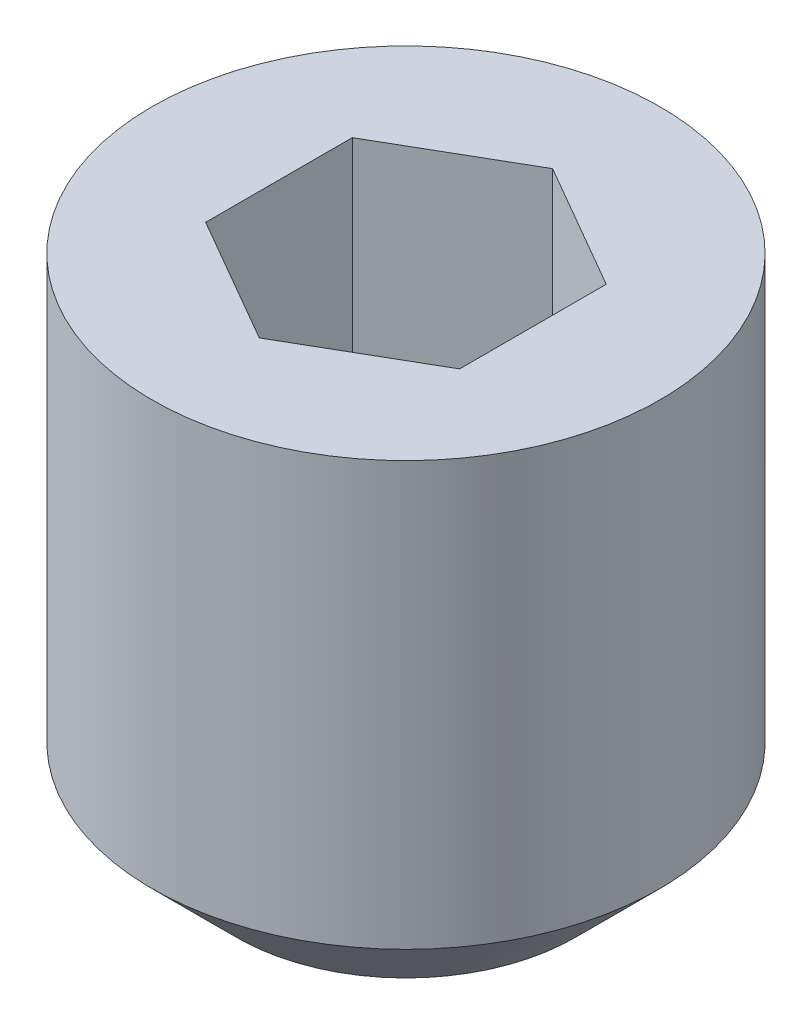
from build123d import *

# Parameters (mm, degrees)
SKETCH1_W          = 1.5
SKETCH1_H          = 3
CUT_EXTRUDE1_DEPTH = 1.2


with BuildPart() as part:
    # Sketch1 → Revolve1 (revolve)
    with BuildSketch(Plane.XY, mode=Mode.PRIVATE) as revolve1_sk:
        with Locations((0.75, 1.5)):
            Rectangle(SKETCH1_W, SKETCH1_H)
    revolve(revolve1_sk.sketch.rotate(Axis((0, 3, 0), (0, -1, 0)), 180), axis=Axis((0, 3, 0), (0, -1, 0)))

    # Sketch2 → Cut-Revolve1 (revolve, cut)
    with BuildSketch(Plane.XY, mode=Mode.PRIVATE) as cut_revolve1_sk:
        Polygon((0, 3), (0.75, 3), (0.75, 1.8), (0, 1.366987298), align=None)
    revolve(cut_revolve1_sk.sketch.rotate(Axis((0, 3, 0), (0, -1, 0)), 180), axis=Axis((0, 3, 0), (0, -1, 0)), mode=Mode.SUBTRACT)

    # Sketch3 → Cut-Extrude1 (cut)
    with BuildSketch(Plane(origin=(0, 3, 0), x_dir=(1, 0, 0), z_dir=(0, 1, 0))):
        Polygon((0, 0.866025404), (-0.75, 0.433012702), (-0.75, -0.433012702), (0, -0.866025404), (0.75, -0.433012702), (0.75, 0.433012702), align=None)
    extrude(amount=-CUT_EXTRUDE1_DEPTH, mode=Mode.SUBTRACT)

    # Sketch4 → Cut-Revolve2 (revolve, cut)
    with BuildSketch(Plane.XY, mode=Mode.PRIVATE) as cut_revolve2_sk:
        Polygon((1, 0), (1.5, 0), (1.5, 0.5), align=None)
    revolve(cut_revolve2_sk.sketch.rotate(Axis((0, 0, 0), (0, 1, 0)), 180), axis=Axis((0, 0, 0), (0, 1, 0)), mode=Mode.SUBTRACT)


solid = part.part
